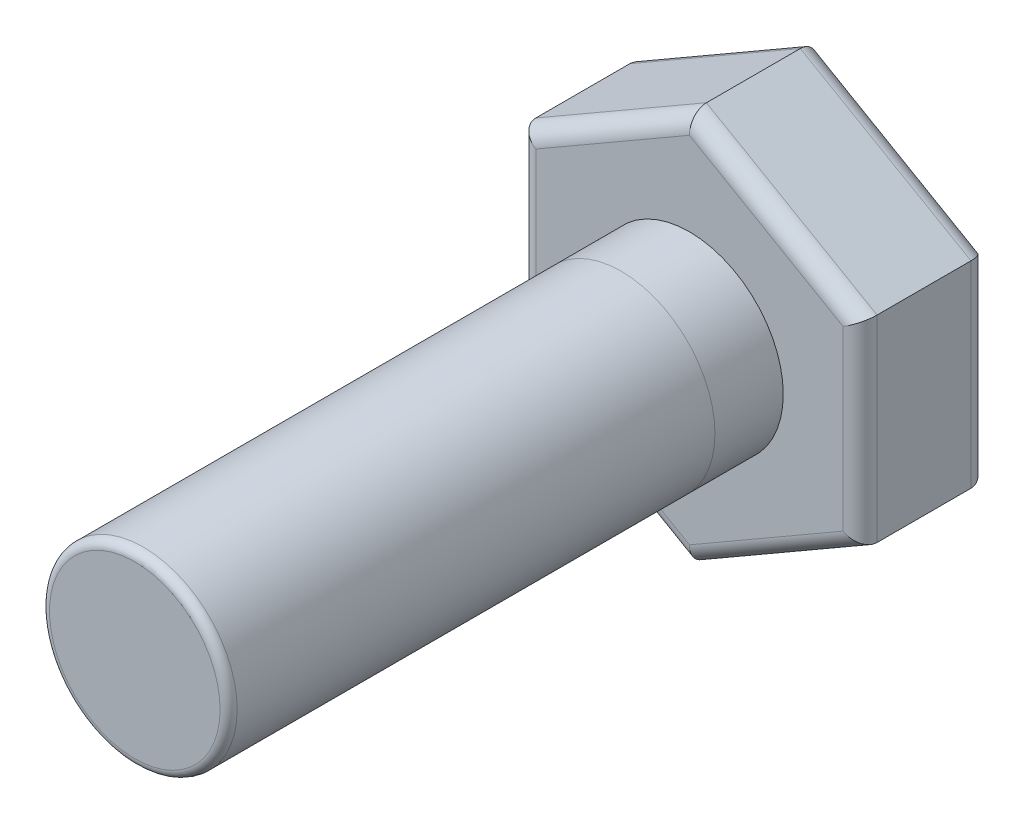
from build123d import *

# Parameters (mm, degrees)
EXTRUDE_437_DEPTH = 15
SKETCH_2_R        = 11
EXTRUDE_1_DEPTH   = 8
FILLET_3_R        = 2
SKETCH_3_R        = 10.995
EXTRUDE_1_2_DEPTH = 57
FILLET_4_R        = 1


with BuildPart() as part:
    # 草图1 → Extrude 437 (new body)
    with BuildSketch(Plane.XY):
        Polygon((20, 11.547005384), (0, 23.094010768), (-20, 11.547005384), (-20, -11.547005384), (0, -23.094010768), (20, -11.547005384), align=None)
    extrude(amount=EXTRUDE_437_DEPTH)

    # 草图2 → Extrude 1 (add)
    with BuildSketch(Plane.XY.offset(15)):
        Circle(SKETCH_2_R)
    extrude(amount=EXTRUDE_1_DEPTH)

    # 圆角3
    fillet_3_edges = [part.edges().sort_by_distance(p)[0] for p in [
        (-10, 17.320508076, 15),
        (-20, 0, 15),
        (-10, -17.320508076, 15),
        (10, -17.320508076, 15),
        (20, 0, 15),
        (10, -17.320508076, 0),
        (-10, -17.320508076, 0),
        (-20, 0, 0),
        (10, 17.320508076, 15),
        (-10, 17.320508076, 0),
        (10, 17.320508076, 0),
        (20, 0, 0),
    ]]
    fillet(fillet_3_edges, radius=FILLET_3_R)

    # 草图3 → Extrude 1 2 (add)
    with BuildSketch(Plane.XY.offset(23)):
        Circle(SKETCH_3_R)
    extrude(amount=EXTRUDE_1_2_DEPTH)

    # 圆角4
    fillet_4_edges = [part.edges().sort_by_distance(p)[0] for p in [
        (-10.995, 0, 80),
    ]]
    fillet(fillet_4_edges, radius=FILLET_4_R)


solid = part.part
